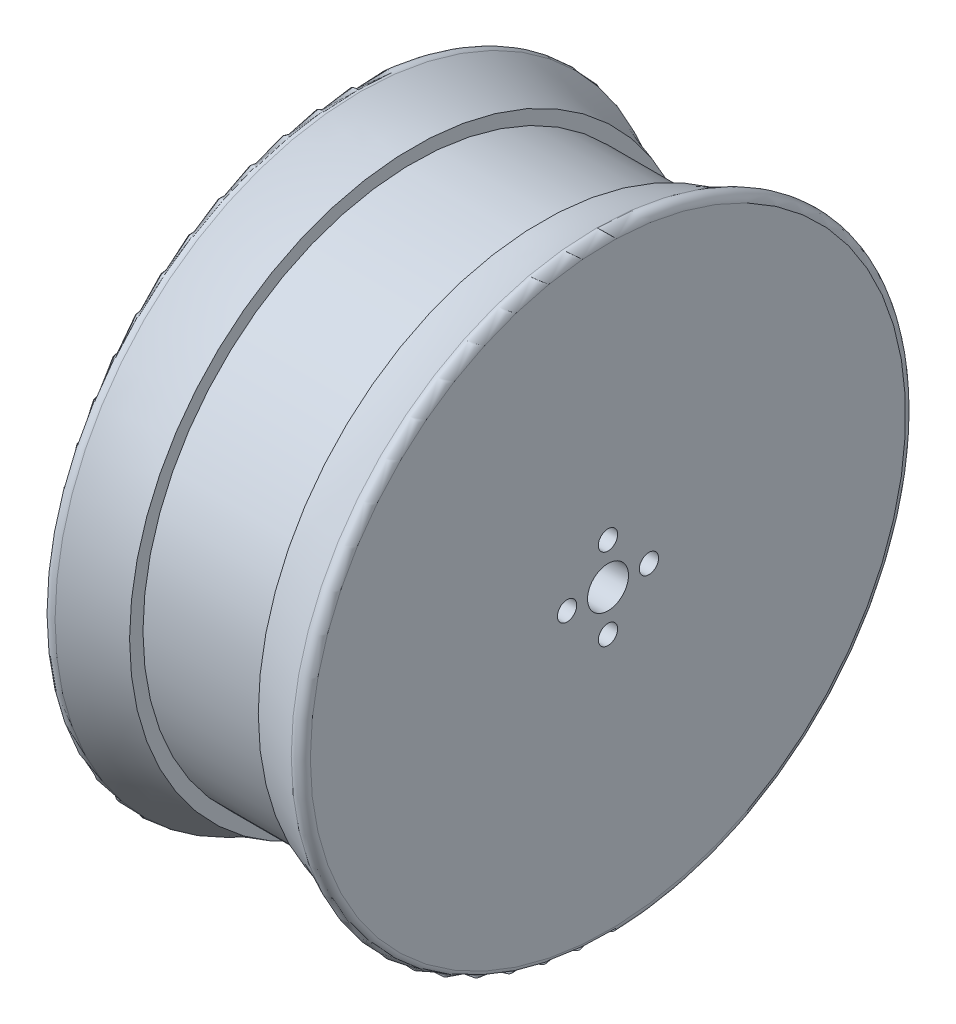
from build123d import *

# Parameters (mm, degrees)
FLOWER_R       = 4
FLOWER_R_2     = 1.885
MOUNTING_DEPTH = 99.604197228


with BuildPart() as part:
    # Wheel Arc → Wheel (revolve)
    with BuildSketch(Plane.XY, mode=Mode.PRIVATE) as wheel_sk:
        with BuildLine():
            Line((-25.4, 0), (25.4, 0))
            Line((25.4, 0), (25.4, -58.170962527))
            ThreePointArc((25.4, -58.170962527), (24.634795193, -59.528897306), (23.076866942, -59.577731965))
            ThreePointArc((23.076866942, -59.577731965), (17.93994263, -57.251785424), (12.573, -55.521483285))
            Line((12.573, -55.521483285), (12.573, -52.9082))
            Line((12.573, -52.9082), (-12.573, -52.9082))
            Line((-12.573, -52.9082), (-12.573, -55.521483285))
            ThreePointArc((-12.573, -55.521483285), (-17.93994263, -57.251785424), (-23.076866942, -59.577731965))
            ThreePointArc((-23.076866942, -59.577731965), (-24.634795193, -59.528897306), (-25.4, -58.170962527))
            Line((-25.4, -58.170962527), (-25.4, 0))
        make_face()
    revolve(wheel_sk.sketch.rotate(Axis((-40.905271883, 0, 0), (1, 0, 0)), 270), axis=Axis((-40.905271883, 0, 0), (1, 0, 0)))

    # Flower → Mounting (cut, through all)
    with BuildSketch(Plane(origin=(25.4, 0, 0), x_dir=(0, 0, -1), z_dir=(1, 0, 0))):
        Circle(FLOWER_R)
        with Locations((0, 8)):
            Circle(FLOWER_R_2)
        with Locations((8, 0)):
            Circle(FLOWER_R_2)
        with Locations((0, -8)):
            Circle(FLOWER_R_2)
        with Locations((-8, 0)):
            Circle(FLOWER_R_2)
    extrude(amount=-MOUNTING_DEPTH, mode=Mode.SUBTRACT)


solid = part.part
